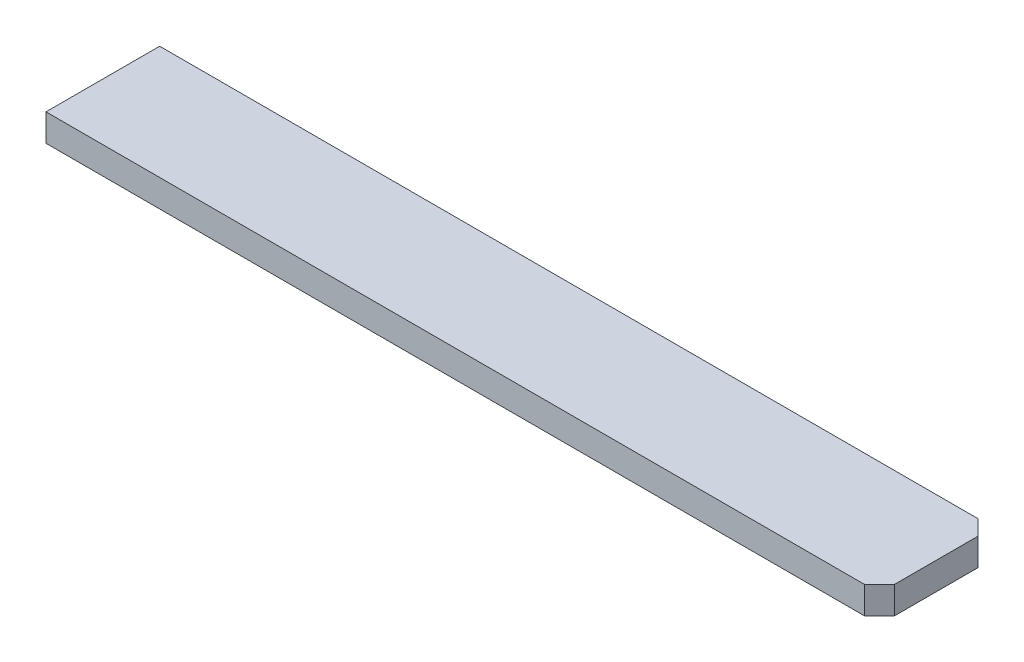
from build123d import *

# Parameters (mm, degrees)
SKETCH1_W           = 550
SKETCH1_H           = 18
BOSS_EXTRUDE1_DEPTH = 37.5
CHAMFER1_SIZE       = 10
SKETCH3_R           = 2
CUT_EXTRUDE1_DEPTH  = 35


with BuildPart() as part:
    # Sketch1 → Boss-Extrude1 (new, symmetric)
    with BuildSketch(Plane.XY):
        with Locations((257, 9)):
            Rectangle(SKETCH1_W, SKETCH1_H)
    extrude(amount=BOSS_EXTRUDE1_DEPTH, both=True)

    # Chamfer1
    chamfer1_edges = [part.edges().sort_by_distance(p)[0] for p in [
        (532, 9, 37.5),
        (532, 9, -37.5),
    ]]
    chamfer(chamfer1_edges, length=CHAMFER1_SIZE)

    # Sketch3 → Cut-Extrude1 (cut)
    with BuildSketch(Plane(origin=(-18, 0, 0), x_dir=(0, 0, -1), z_dir=(1, 0, 0))):
        with Locations(Location((0, 9, 0), (0, 0, 90))):
            Circle(SKETCH3_R)
    extrude(amount=CUT_EXTRUDE1_DEPTH, mode=Mode.SUBTRACT)


solid = part.part
